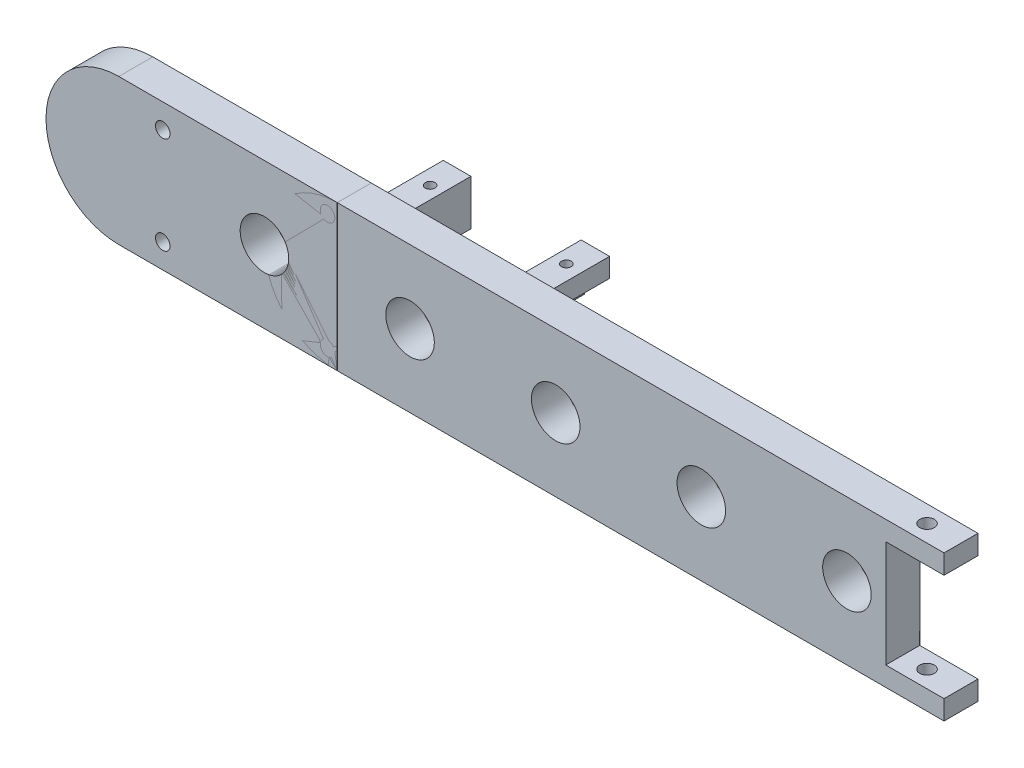
from build123d import *

# Parameters (mm, degrees)
BOSS_EXTRUDE1_DEPTH             = 7
SKETCH2_R                       = 5
CUT_EXTRUDE1_DEPTH              = 7
LPATTERN1_COUNT                 = 7
LPATTERN1_PITCH                 = 30
SKETCH6_R                       = 5
CUT_EXTRUDE2_DEPTH              = 10
BOSS_EXTRUDE2_DEPTH             = 21
CUT_EXTRUDE3_DEPTH              = 21
CUT_EXTRUDE4_REACH              = 220.014
SKETCH9_R                       = 1.5
CUT_EXTRUDE5_REACH              = 220.771
SKETCH10_W                      = 5.271518542
SKETCH10_H                      = 23.219312301
BOSS_EXTRUDE3_DEPTH             = 14
CUT_EXTRUDE6_DEPTH              = 1
CUT_EXTRUDE6_DEPTH_BACK         = 22
SKETCH12_W                      = 22.7
SKETCH12_H                      = 12.3
SKETCH12_H_2                    = 14.702182947
CUT_EXTRUDE7_DEPTH              = 7
CUT_EXTRUDE7_DEPTH_BACK         = 7
SKETCH13_R                      = 1
CUT_EXTRUDE8_REACH              = 184.393
SKETCH14_W                      = 12
SKETCH14_H                      = 12
CUT_EXTRUDE10_REACH             = 220.014
SKETCH16_W                      = 140
SKETCH16_H                      = 71.757581457
CUT_EXTRUDE10_DIRECTION_2_DEPTH = 24
SKETCH17_W                      = 7
SKETCH17_H                      = 22
CUT_EXTRUDE11_DEPTH             = 12
SKETCH18_R                      = 1.5
CUT_EXTRUDE12_DEPTH             = 218.533905403
SKETCH19_R                      = 1.5
CUT_EXTRUDE13_DEPTH             = 219.096309001
SKETCH20_R                      = 1.5
BOSS_EXTRUDE4_DEPTH             = 7
SKETCH21_R                      = 1.5
CUT_EXTRUDE14_DEPTH             = 10
CUT_EXTRUDE15_DEPTH             = 263.566182133
CUT_EXTRUDE15_DEPTH_BACK        = 263.566182133
SKETCH22_R                      = 5


with BuildPart() as part:
    # Sketch1 → Boss-Extrude1 (new body)
    with BuildSketch(Plane.XY):
        with BuildLine():
            Line((-200, 0), (50, 0))
            ThreePointArc((50, 0), (65, -15), (50, -30))
            Line((50, -30), (-200, -30))
            ThreePointArc((-200, -30), (-215, -15), (-200, 0))
        make_face()
    extrude(amount=BOSS_EXTRUDE1_DEPTH)

    # Sketch2 → Cut-Extrude1 (cut)
    with BuildSketch(Plane.XY.offset(7)):
        with Locations((-185, -15)):
            Circle(SKETCH2_R)
    cut_extrude1 = extrude(amount=-CUT_EXTRUDE1_DEPTH, mode=Mode.SUBTRACT)

    # LPattern1: Cut-Extrude1 ×7
    with Locations(*[(i * LPATTERN1_PITCH, 0, 0) for i in range(1, LPATTERN1_COUNT)]):
        add(cut_extrude1, mode=Mode.SUBTRACT)

    # Sketch6 → Cut-Extrude2 (cut)
    with BuildSketch(Plane(origin=(0, 0, 0), x_dir=(-1, 0, 0), z_dir=(0, 0, -1))):
        with Locations((-50, -15)):
            Circle(SKETCH6_R)
    extrude(amount=-CUT_EXTRUDE2_DEPTH, mode=Mode.SUBTRACT)

    # Sketch7 → Boss-Extrude2 (add)
    with BuildSketch(Plane(origin=(0, 0, 0), x_dir=(0, 0, -1), z_dir=(1, 0, 0))):
        with BuildLine():
            Line((20.124409349, -8.046570755), (20.124409349, -21.391782887))
            ThreePointArc((20.124409349, -21.391782887), (10.062204675, -26.149434806), (0, -21.391782887))
            Line((0, -21.391782887), (0, -8.046570755))
            ThreePointArc((0, -8.046570755), (10.062204675, -2.930122505), (20.124409349, -8.046570755))
        make_face()
    extrude(amount=BOSS_EXTRUDE2_DEPTH)

    # Sketch8 → Cut-Extrude3 (cut)
    with BuildSketch(Plane(origin=(21, 0, 0), x_dir=(0, 0, -1), z_dir=(1, 0, 0))):
        with BuildLine():
            Line((0.343653188, -8.603738845), (0.343653188, -21.003738845))
            Line((0.343653188, -21.003738845), (3.251608919, -23.33010343))
            Line((3.251608919, -23.33010343), (6.11482687, -24.672236845))
            Line((6.11482687, -24.672236845), (10.141227113, -25.388041332))
            Line((10.141227113, -25.388041332), (14.122889575, -24.672236845))
            Line((14.122889575, -24.672236845), (17.165058648, -23.33010343))
            Line((17.165058648, -23.33010343), (19.670374355, -20.953281344))
            Line((19.670374355, -20.953281344), (19.670374355, -8.553281344))
            ThreePointArc((19.670374355, -8.553281344), (9.994377841, -3.738573545), (0.343653188, -8.603738845))
        make_face()
    extrude(amount=-CUT_EXTRUDE3_DEPTH, mode=Mode.SUBTRACT)

    # Sketch9 → Cut-Extrude4 (cut, up to next)
    with BuildSketch(Plane(origin=(0, 0, 0), x_dir=(-1, 0, 0), z_dir=(0, 0, -1)), mode=Mode.PRIVATE) as cut_extrude4_sk1:
        with Locations((-29.5, -6.25)):
            Circle(SKETCH9_R)
    cut_extrude4_tool1 = extrude(cut_extrude4_sk1.sketch, amount=-CUT_EXTRUDE4_REACH, mode=Mode.PRIVATE) & part.part
    # Sketch9 → Cut-Extrude4 (cut, up to next)
    with BuildSketch(Plane(origin=(0, 0, 0), x_dir=(-1, 0, 0), z_dir=(0, 0, -1)), mode=Mode.PRIVATE) as cut_extrude4_sk2:
        with Locations((-29.5, -23.75)):
            Circle(SKETCH9_R)
    cut_extrude4_tool2 = extrude(cut_extrude4_sk2.sketch, amount=-CUT_EXTRUDE4_REACH, mode=Mode.PRIVATE) & part.part
    add(cut_extrude4_tool1.solids().sort_by_distance((29.5, -6.25, 0))[0], mode=Mode.SUBTRACT)
    add(cut_extrude4_tool2.solids().sort_by_distance((29.5, -23.75, 0))[0], mode=Mode.SUBTRACT)

    # Cut-Extrude5: up to this face of the body (flat: up to its plane)
    cut_extrude5_end = Plane(part.part.faces().sort_by_distance((-78.33059512, -15.01080435, 0))[0])
    # Sketch10 → Cut-Extrude5 (cut, up to the picked face)
    with BuildSketch(Plane(origin=(0, 0, -20.124409349), x_dir=(-1, 0, 0), z_dir=(0, 0, -1)), mode=Mode.PRIVATE) as cut_extrude5_sk1:
        with Locations((-2.635759271, -14.539778656)):
            Rectangle(SKETCH10_W, SKETCH10_H)
    cut_extrude5_tool1 = split(extrude(cut_extrude5_sk1.sketch, amount=-CUT_EXTRUDE5_REACH, mode=Mode.PRIVATE), bisect_by=cut_extrude5_end, keep=Keep.BOTH, mode=Mode.PRIVATE)
    add(cut_extrude5_tool1.solids().sort_by(Axis((2.635759, -14.539779, -20.124409), (0, 0, 1)))[0], mode=Mode.SUBTRACT)

    # Sketch11 → Boss-Extrude3 (add)
    with BuildSketch(Plane(origin=(0, 0, 0), x_dir=(-1, 0, 0), z_dir=(0, 0, -1))):
        Polygon((60.097644306, -6.420008597), (60.097644306, -23.913431972), (36.21993437, -23.913431972), (36.21993437, -6.613282571), (31.020509523, -6.613282571), (31.020509523, -2.674883318), (65.276628567, -2.674883318), (65.276628567, -6.420008597), align=None)
        Polygon((193.975354243, -6.285954501), (193.975354243, -16.540829221), (170.097644306, -16.540829221), (170.097644306, -6.479228475), (164.898219459, -6.479228475), (164.898219459, -2.540829221), (199.154338504, -2.540829221), (199.154338504, -6.285954501), align=None)
    extrude(amount=BOSS_EXTRUDE3_DEPTH)

    # Sketch12 → Cut-Extrude6 (cut, two sides: drawn at the far end of the back side and taken through both)
    with BuildSketch(Plane(origin=(0, -2.674883318, 0), x_dir=(1, 0, 0), z_dir=(0, 1, 0)).offset(-CUT_EXTRUDE6_DEPTH_BACK)):
        with Locations((-48.226628567, 6.703751831)):
            Rectangle(SKETCH12_W, SKETCH12_H)
        with Locations((-182.104338504, 7.624156034)):
            Rectangle(SKETCH12_W, SKETCH12_H_2)
    extrude(amount=CUT_EXTRUDE6_DEPTH + CUT_EXTRUDE6_DEPTH_BACK, mode=Mode.SUBTRACT)

    # Sketch13 → Cut-Extrude7 (cut, two sides: drawn at the far end of the back side and taken through both)
    with BuildSketch(Plane(origin=(0, -2.674883318, 0), x_dir=(1, 0, 0), z_dir=(0, 1, 0)).offset(-CUT_EXTRUDE7_DEPTH_BACK)):
        with Locations(Location((-167.998219459, 8.19, 0), (0, 0, 90))):
            Circle(SKETCH13_R)
        with Locations(Location((-196.054338504, 8.19, 0), (0, 0, 90))):
            Circle(SKETCH13_R)
        with Locations(Location((-62.176628567, 8.19, 0), (0, 0, 90))):
            Circle(SKETCH13_R)
        with Locations(Location((-34.120509523, 8.19, 0), (0, 0, 90))):
            Circle(SKETCH13_R)
    extrude(amount=CUT_EXTRUDE7_DEPTH + CUT_EXTRUDE7_DEPTH_BACK, mode=Mode.SUBTRACT)

    # Cut-Extrude8: up to this face of the body (flat: up to its plane)
    cut_extrude8_end = Plane(part.part.faces().sort_by_distance((-193.975354243, -11.413391861, -7))[0])
    # Sketch14 → Cut-Extrude8 (cut, up to the picked face)
    with BuildSketch(Plane(origin=(-36.21993437, 0, 0), x_dir=(0, 0, -1), z_dir=(1, 0, 0)), mode=Mode.PRIVATE) as cut_extrude8_sk1:
        with Locations((8, -17.913431972)):
            Rectangle(SKETCH14_W, SKETCH14_H)
    cut_extrude8_tool1 = split(extrude(cut_extrude8_sk1.sketch, amount=-CUT_EXTRUDE8_REACH, mode=Mode.PRIVATE), bisect_by=cut_extrude8_end, keep=Keep.BOTH, mode=Mode.PRIVATE)
    add(cut_extrude8_tool1.solids().sort_by(Axis((-36.219934, -17.913432, -8), (-1, 0, 0)))[0], mode=Mode.SUBTRACT)

    # Sketch16 → Cut-Extrude10 (cut, up to next)
    with BuildSketch(Plane(origin=(0, 0, 0), x_dir=(-1, 0, 0), z_dir=(0, 0, -1)), mode=Mode.PRIVATE) as cut_extrude10_sk1:
        with Locations((5, -12.999910307)):
            Rectangle(SKETCH16_W, SKETCH16_H)
    cut_extrude10_tool1 = extrude(cut_extrude10_sk1.sketch, amount=-CUT_EXTRUDE10_REACH, mode=Mode.PRIVATE) & part.part
    add(cut_extrude10_tool1.solids().sort_by_distance((-5, -12.99991, 0))[0], mode=Mode.SUBTRACT)

    # Sketch16 → Cut-Extrude10 direction 2 (cut)
    with BuildSketch(Plane(origin=(0, 0, 0), x_dir=(-1, 0, 0), z_dir=(0, 0, -1))):
        with Locations((5, -12.999910307)):
            Rectangle(SKETCH16_W, SKETCH16_H)
    extrude(amount=CUT_EXTRUDE10_DIRECTION_2_DEPTH, mode=Mode.SUBTRACT)

    # Sketch17 → Cut-Extrude11 (cut)
    with BuildSketch(Plane(origin=(-75, 0, 0), x_dir=(0, 0, -1), z_dir=(1, 0, 0))):
        with Locations((-3.5, -15)):
            Rectangle(SKETCH17_W, SKETCH17_H)
    extrude(amount=-CUT_EXTRUDE11_DEPTH, mode=Mode.SUBTRACT)

    # Sketch18 → Cut-Extrude12 (cut, through all)
    with BuildSketch(Plane(origin=(0, 0, 0), x_dir=(1, 0, 0), z_dir=(0, 1, 0))):
        with Locations(Location((-82, -3.5, 0), (0, 0, 180))):
            Circle(SKETCH18_R)
    extrude(amount=-CUT_EXTRUDE12_DEPTH, mode=Mode.SUBTRACT)

    # Sketch19 → Cut-Extrude13 (cut, through all)
    with BuildSketch(Plane.XY.offset(7)):
        with Locations((-202, -3)):
            Circle(SKETCH19_R)
        with Locations((-202, -27)):
            Circle(SKETCH19_R)
    extrude(amount=-CUT_EXTRUDE13_DEPTH, mode=Mode.SUBTRACT)


with BuildPart() as body_2:
    # Sketch20 → Boss-Extrude4 (new body)
    # profile 1 of 5: a face of its own
    with BuildSketch(Plane.XY.offset(7)):
        with BuildLine():
            Line((-200, 0), (-245, 0))
            Line((-245, 0), (-245, -30))
            Line((-245, -30), (-200, -30))
            ThreePointArc((-200, -30), (-215, -15), (-200, 0))
        make_face()
    # profile 2 of 5: a face of its own
    with BuildSketch(Plane.XY.offset(7)):
        with BuildLine():
            Line((-245, 0), (-245, -30))
            ThreePointArc((-245, -30), (-260, -15), (-245, 0))
        make_face()
    # profile 3 of 5: a face of its own
    with BuildSketch(Plane.XY.offset(7)):
        with BuildLine():
            Line((-200, 0), (-200, -30))
            ThreePointArc((-200, -30), (-215, -15), (-200, 0))
        make_face()
        with Locations((-202, -27)):
            Circle(SKETCH20_R, mode=Mode.SUBTRACT)
        with Locations((-202, -3)):
            Circle(SKETCH20_R, mode=Mode.SUBTRACT)
    # profile 4 of 5: a face of its own
    with BuildSketch(Plane.XY.offset(7)):
        with Locations((-202, -27)):
            Circle(SKETCH20_R)
    # profile 5 of 5: a face of its own
    with BuildSketch(Plane.XY.offset(7)):
        with Locations((-202, -3)):
            Circle(SKETCH20_R)
    extrude(amount=-BOSS_EXTRUDE4_DEPTH)

    # Sketch21 → Cut-Extrude14 (cut)
    with BuildSketch(Plane.XY.offset(7)):
        with Locations((-235.95, -25)):
            Circle(SKETCH21_R)
        with Locations((-235.95, -5)):
            Circle(SKETCH21_R)
    extrude(amount=-CUT_EXTRUDE14_DEPTH, mode=Mode.SUBTRACT)


with BuildPart() as cut_extrude15_tool:
    # Sketch22 → Cut-Extrude15 (new, two sides: drawn at the far end of the back side and taken through both)
    with BuildSketch(Plane.XY.offset(7).offset(-CUT_EXTRUDE15_DEPTH_BACK)):
        with Locations((-215, -15)):
            Circle(SKETCH22_R)
    extrude(amount=CUT_EXTRUDE15_DEPTH + CUT_EXTRUDE15_DEPTH_BACK)


with BuildPart() as part_1:
    add(part.part)

    # Cut-Extrude15: cut by cut_extrude15_tool
    add(cut_extrude15_tool.part, mode=Mode.SUBTRACT)


with BuildPart() as body_2_1:
    add(body_2.part)

    # Cut-Extrude15: cut by cut_extrude15_tool
    add(cut_extrude15_tool.part, mode=Mode.SUBTRACT)


solid = Compound([part_1.part, body_2_1.part])
